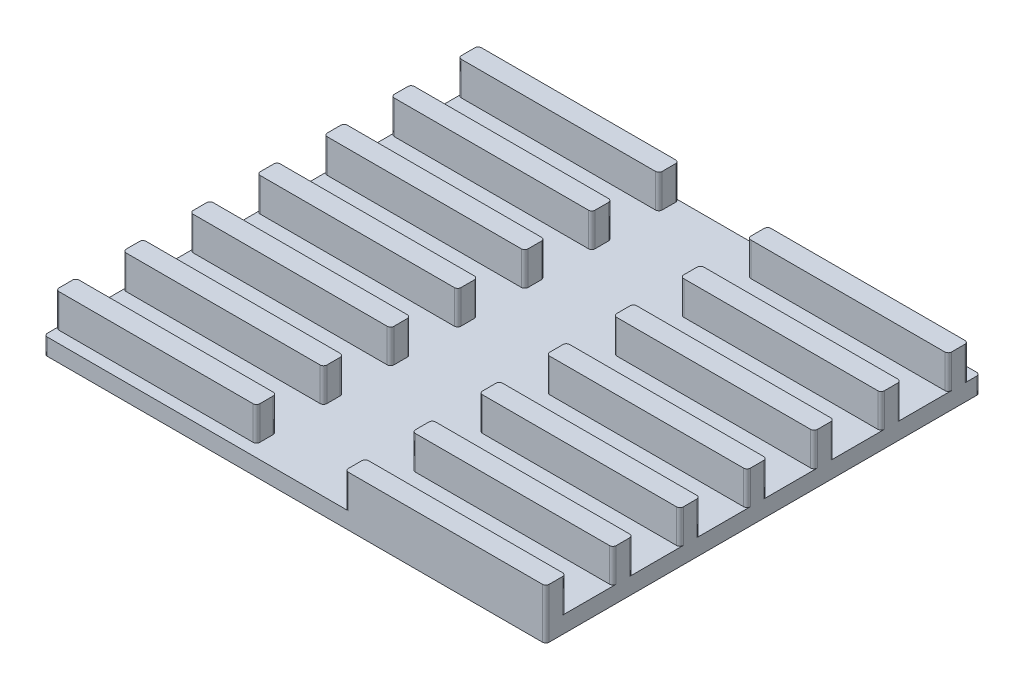
from build123d import *

# Parameters (mm, degrees)
SKETCH1_W           = 150
SKETCH1_H           = 129.788
BOSS_EXTRUDE1_DEPTH = 5
SKETCH1_3_W         = 60
SKETCH1_3_H         = 6
BOSS_EXTRUDE2_DEPTH = 15
FILLET1_R           = 1


with BuildPart() as part:
    # Sketch1 → Boss-Extrude1 (new body)
    with BuildSketch(Plane(origin=(0, 0, 0), x_dir=(1, 0, 0), z_dir=(0, 1, 0))):
        with Locations((0, -1.75)):
            Rectangle(SKETCH1_W, SKETCH1_H)
    extrude(amount=BOSS_EXTRUDE1_DEPTH)

    # Sketch1<3> → Boss-Extrude2 (add)
    with BuildSketch(Plane(origin=(0, 0, 0), x_dir=(1, 0, 0), z_dir=(0, 1, 0))):
        with Locations((-45, 60.144)):
            Rectangle(SKETCH1_3_W, SKETCH1_3_H)
        with Locations((-45, 40.096)):
            Rectangle(SKETCH1_3_W, SKETCH1_3_H)
        with Locations((-45, 20.048)):
            Rectangle(SKETCH1_3_W, SKETCH1_3_H)
        with Locations((-45, 0)):
            Rectangle(SKETCH1_3_W, SKETCH1_3_H)
        with Locations((45, 56.644)):
            Rectangle(SKETCH1_3_W, SKETCH1_3_H)
        with Locations((45, 36.596)):
            Rectangle(SKETCH1_3_W, SKETCH1_3_H)
        with Locations((45, 16.548)):
            Rectangle(SKETCH1_3_W, SKETCH1_3_H)
        with Locations((45, -3.5)):
            Rectangle(SKETCH1_3_W, SKETCH1_3_H)
        with Locations((-45, -20.048)):
            Rectangle(SKETCH1_3_W, SKETCH1_3_H)
        with Locations((-45, -40.096)):
            Rectangle(SKETCH1_3_W, SKETCH1_3_H)
        with Locations((-45, -60.144)):
            Rectangle(SKETCH1_3_W, SKETCH1_3_H)
        with Locations((45, -23.548)):
            Rectangle(SKETCH1_3_W, SKETCH1_3_H)
        with Locations((45, -43.596)):
            Rectangle(SKETCH1_3_W, SKETCH1_3_H)
        with Locations((45, -63.644)):
            Rectangle(SKETCH1_3_W, SKETCH1_3_H)
    extrude(amount=BOSS_EXTRUDE2_DEPTH)

    # Fillet1
    fillet1_edges = [part.edges().sort_by_distance(p)[0] for p in [
        (-75, 2.5, 66.644),
        (75, 2.5, -63.144),
        (75, 10, 60.644),
        (75, 10, 40.596),
        (75, 10, 20.548),
        (75, 10, 0.5),
        (75, 10, -19.548),
        (75, 10, -59.644),
        (75, 10, -39.596),
        (-15, 10, -63.144),
        (-15, 10, -43.096),
        (-15, 10, -23.048),
        (-15, 10, -3),
        (-15, 10, 17.048),
        (-15, 10, 37.096),
        (-15, 10, 57.144),
        (-15, 10, 63.144),
        (-15, 10, 43.096),
        (-15, 10, 23.048),
        (-15, 10, 3),
        (-15, 10, -17.048),
        (-15, 10, -37.096),
        (-15, 10, -57.144),
        (75, 10, -53.644),
        (75, 10, -33.596),
        (75, 10, -13.548),
        (75, 10, 6.5),
        (75, 10, 26.548),
        (75, 10, 46.596),
        (75, 7.5, 66.644),
        (15, 10, 66.644),
        (15, 10, 60.644),
        (15, 10, 46.596),
        (15, 10, 40.596),
        (15, 10, 26.548),
        (15, 10, 20.548),
        (15, 10, 0.5),
        (15, 10, 6.5),
        (15, 10, -13.548),
        (15, 10, -19.548),
        (15, 10, -33.596),
        (15, 10, -39.596),
        (15, 10, -53.644),
        (15, 10, -59.644),
        (-75, 10, 63.144),
        (-75, 10, 57.144),
        (-75, 10, 43.096),
        (-75, 10, 37.096),
        (-75, 10, 23.048),
        (-75, 10, 17.048),
        (-75, 10, 3),
        (-75, 10, -3),
        (-75, 10, -17.048),
        (-75, 10, -23.048),
        (-75, 10, -37.096),
        (-75, 10, -43.096),
        (-75, 7.5, -63.144),
        (-75, 10, -57.144),
    ]]
    fillet(fillet1_edges, radius=FILLET1_R)


solid = part.part
